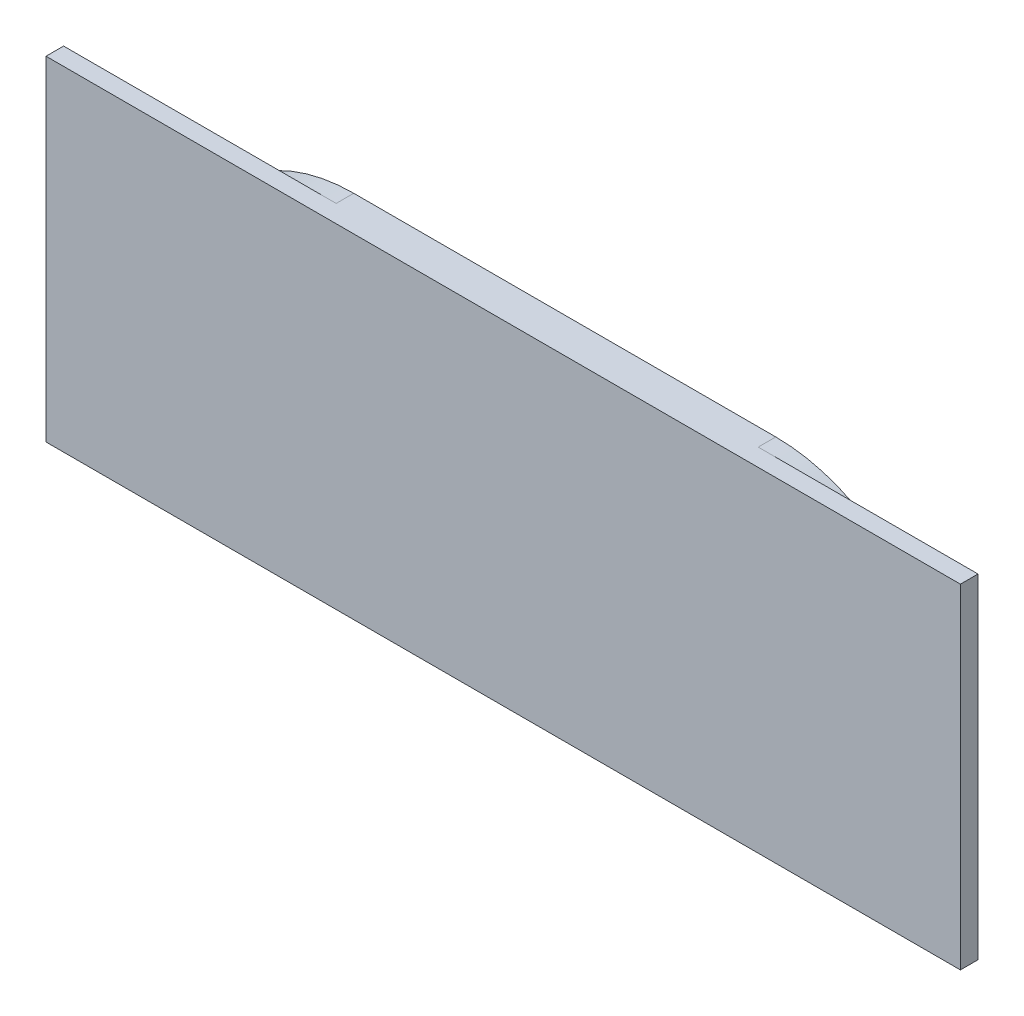
from build123d import *

# Parameters (mm, degrees)
SALIENTE_EXTRUIR1_DEPTH = 1
SALIENTE_EXTRUIR2_DEPTH = 1


with BuildPart() as part:
    # Croquis1 → Saliente-Extruir1 (new body)
    with BuildSketch(Plane.XY):
        with BuildLine():
            Line((-102.798975089, 22.90959253), (-78.798975089, 22.90959253))
            ThreePointArc((-78.798975089, 22.90959253), (-69.298975089, 13.40959253), (-78.798975089, 3.90959253))
            Line((-78.798975089, 3.90959253), (-102.798975089, 3.90959253))
            ThreePointArc((-102.798975089, 3.90959253), (-112.298975089, 13.40959253), (-102.798975089, 22.90959253))
        make_face()
    extrude(amount=SALIENTE_EXTRUIR1_DEPTH)

    # Croquis2 → Saliente-Extruir2 (add)
    with BuildSketch(Plane.XY.offset(1)):
        Polygon((-90.798975089, 22.90959253), (-118.298975089, 22.90959253), (-118.298975089, 3.90959253), (-66.298975089, 3.90959253), (-66.298975089, 22.90959253), align=None)
    extrude(amount=SALIENTE_EXTRUIR2_DEPTH)


solid = part.part
